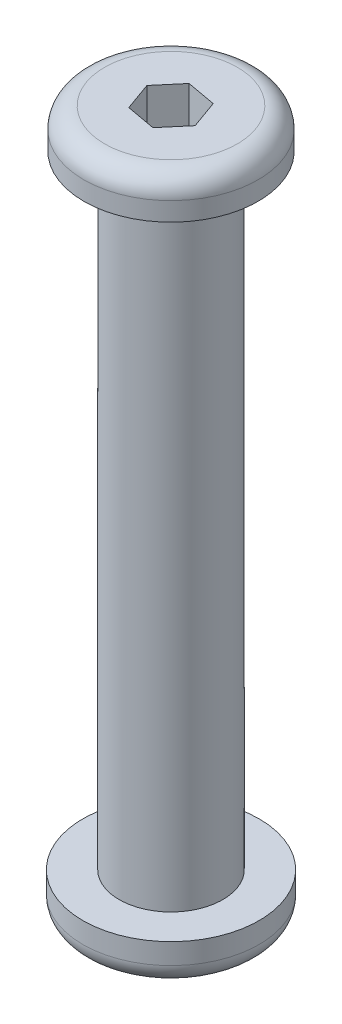
from build123d import *

# Parameters (mm, degrees)
SKETCH_1_R      = 2.5
EXTRUDE_1_DEPTH = 30
SKETCH_2_R      = 4.2
EXTRUDE_2_DEPTH = 1.9
SKETCH_3_R      = 4.25
EXTRUDE_3_DEPTH = 2
FILLET_1_R      = 1


with BuildPart() as part:
    # 草图1 → 凸台-拉伸1 (new body)
    with BuildSketch(Plane(origin=(0, 0, 0), x_dir=(1, 0, 0), z_dir=(0, 1, 0))):
        with Locations(Location((0, 0, 0), (0, 0, 270))):
            Circle(SKETCH_1_R)
    extrude(amount=EXTRUDE_1_DEPTH)

    # 草图2 → 凸台-拉伸2 (add)
    with BuildSketch(Plane(origin=(0, 30, 0), x_dir=(1, 0, 0), z_dir=(0, 1, 0))):
        with Locations(Location((0, 0, 0), (0, 0, 90))):
            Circle(SKETCH_2_R)
        Polygon((0.933529185, 1.100843583), (-0.486593916, 1.358881781), (-1.420123101, 0.258038198), (-0.933529185, -1.100843583), (0.486593916, -1.358881781), (1.420123101, -0.258038198), align=None, mode=Mode.SUBTRACT)
    extrude(amount=EXTRUDE_2_DEPTH)

    # 草图3 → 凸台-拉伸3 (add)
    with BuildSketch(Plane.XZ):
        with Locations(Location((0, 0, 0), (0, 0, 270))):
            Circle(SKETCH_3_R)
        Polygon((0.831789315, 1.179601572), (-0.605670271, 1.310151463), (-1.437459585, 0.130549891), (-0.831789315, -1.179601572), (0.605670271, -1.310151463), (1.437459585, -0.130549891), align=None, mode=Mode.SUBTRACT)
    extrude(amount=EXTRUDE_3_DEPTH)

    # 圆角1
    fillet_1_edges = [part.edges().sort_by_distance(p)[0] for p in [
        (0, 31.9, 4.2),
        (0, -2, 4.25),
    ]]
    fillet(fillet_1_edges, radius=FILLET_1_R)


solid = part.part
